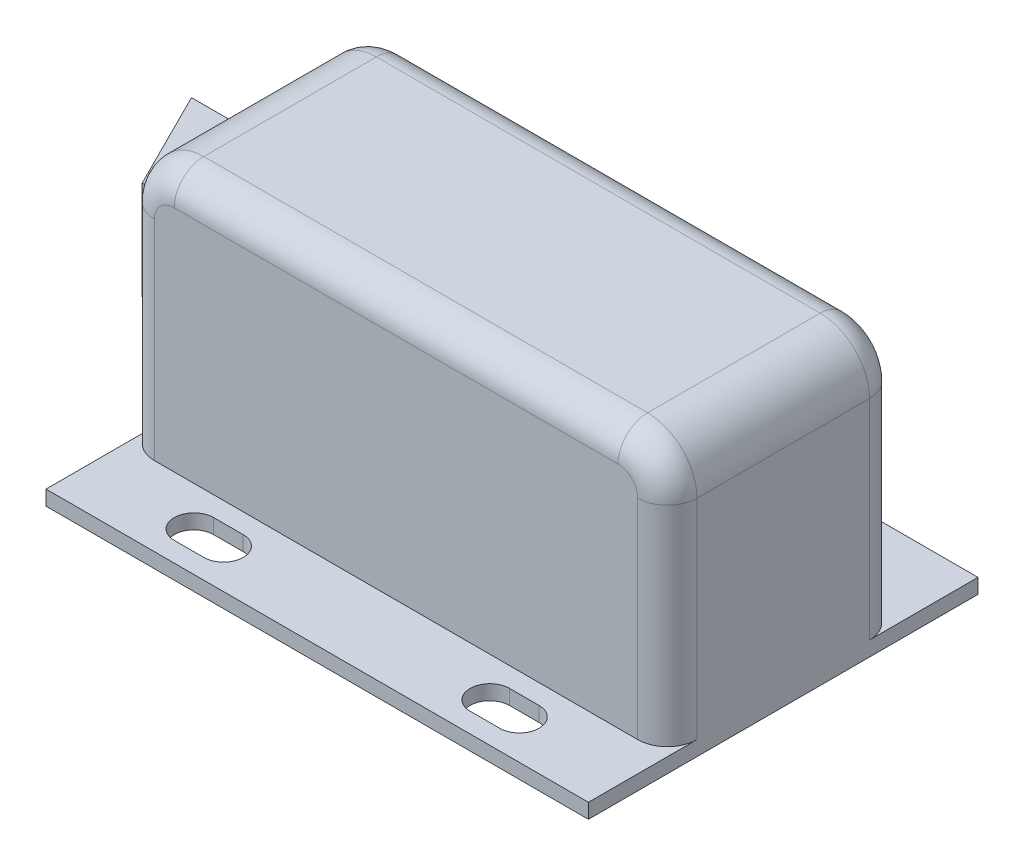
from build123d import *

# Parameters (mm, degrees)
SKETCH1_W           = 55
SKETCH1_H           = 39.5
BOSS_EXTRUDE1_DEPTH = 27.7
SKETCH2_W           = 8
SKETCH2_H           = 26.2
CUT_EXTRUDE1_DEPTH  = 65.877365082
SKETCH3_W           = 8
SKETCH3_H           = 26.2
CUT_EXTRUDE2_DEPTH  = 65.877365082
CUT_EXTRUDE3_DEPTH  = 50.345111207
CUT_EXTRUDE4_DEPTH  = 51.15765146
CUT_EXTRUDE5_DEPTH  = 50.345111207
CUT_EXTRUDE6_DEPTH  = 51.15765146
BOSS_EXTRUDE2_DEPTH = 10
FILLET1_R           = 5
FILLET2_R           = 3


with BuildPart() as part:
    # Sketch1 → Boss-Extrude1 (new body)
    with BuildSketch(Plane(origin=(0, 13.85, 0), x_dir=(1, 0, 0), z_dir=(0, 1, 0))):
        with Locations((0, -11.75)):
            Rectangle(SKETCH1_W, SKETCH1_H)
    extrude(amount=-BOSS_EXTRUDE1_DEPTH)

    # Sketch2 → Cut-Extrude1 (cut, through all)
    with BuildSketch(Plane.ZY.offset(27.5)):
        with Locations((27.5, 0.75)):
            Rectangle(SKETCH2_W, SKETCH2_H)
    extrude(amount=-CUT_EXTRUDE1_DEPTH, mode=Mode.SUBTRACT)

    # Sketch3 → Cut-Extrude2 (cut, through all)
    with BuildSketch(Plane.ZY.offset(27.5)):
        with Locations((-4, 0.75)):
            Rectangle(SKETCH3_W, SKETCH3_H)
    extrude(amount=-CUT_EXTRUDE2_DEPTH, mode=Mode.SUBTRACT)

    # Sketch4 → Cut-Extrude3 (cut, through all)
    with BuildSketch(Plane(origin=(0, -12.35, 0), x_dir=(-1, 0, 0), z_dir=(0, 1, 0))):
        with BuildLine():
            Line((-13.5, -2), (-16.5, -2))
            ThreePointArc((-16.5, -2), (-18.5, -4), (-16.5, -6))
            Line((-16.5, -6), (-13.5, -6))
            ThreePointArc((-13.5, -6), (-11.5, -4), (-13.5, -2))
        make_face()
    extrude(amount=-CUT_EXTRUDE3_DEPTH, mode=Mode.SUBTRACT)

    # Sketch5 → Cut-Extrude4 (cut, through all)
    with BuildSketch(Plane.XZ.offset(13.85)):
        with BuildLine():
            Line((-16.5, -6), (-13.5, -6))
            ThreePointArc((-13.5, -6), (-11.5, -4), (-13.5, -2))
            Line((-13.5, -2), (-16.5, -2))
            ThreePointArc((-16.5, -2), (-18.5, -4), (-16.5, -6))
        make_face()
    extrude(amount=-CUT_EXTRUDE4_DEPTH, mode=Mode.SUBTRACT)

    # Sketch6 → Cut-Extrude5 (cut, through all)
    with BuildSketch(Plane(origin=(0, -12.35, 0), x_dir=(-1, 0, 0), z_dir=(0, 1, 0))):
        with BuildLine():
            Line((16.5, 29.5), (13.5, 29.5))
            ThreePointArc((13.5, 29.5), (11.5, 27.5), (13.5, 25.5))
            Line((13.5, 25.5), (16.5, 25.5))
            ThreePointArc((16.5, 25.5), (18.5, 27.5), (16.5, 29.5))
        make_face()
    extrude(amount=-CUT_EXTRUDE5_DEPTH, mode=Mode.SUBTRACT)

    # Sketch7 → Cut-Extrude6 (cut, through all)
    with BuildSketch(Plane.XZ.offset(13.85)):
        with BuildLine():
            Line((13.5, 25.5), (16.5, 25.5))
            ThreePointArc((16.5, 25.5), (18.5, 27.5), (16.5, 29.5))
            Line((16.5, 29.5), (13.5, 29.5))
            ThreePointArc((13.5, 29.5), (11.5, 27.5), (13.5, 25.5))
        make_face()
    extrude(amount=-CUT_EXTRUDE6_DEPTH, mode=Mode.SUBTRACT)

    # Sketch8 → Boss-Extrude2 (add)
    with BuildSketch(Plane.XZ.offset(5.35)):
        Polygon((-32.5, 16.75), (-37.5, 6.75), (-27.5, 6.75), (-27.5, 16.75), align=None)
    extrude(amount=-BOSS_EXTRUDE2_DEPTH)

    # Fillet1
    fillet1_edges = [part.edges().sort_by_distance(p)[0] for p in [
        (27.5, 13.85, 11.75),
        (-27.5, 13.85, 11.75),
    ]]
    fillet(fillet1_edges, radius=FILLET1_R)

    # Fillet2
    fillet2_edges = [part.edges().sort_by_distance(p)[0] for p in [
        (0, 13.85, 0),
        (0, 13.85, 23.5),
        (-26.035533906, 12.385533906, 0),
        (26.035533906, 12.385533906, 0),
        (27.5, -1.75, 23.5),
        (-27.5, -1.75, 23.5),
        (-26.035533906, 12.385533906, 23.5),
        (26.035533906, 12.385533906, 23.5),
        (27.5, -1.75, 0),
        (-27.5, -1.75, 0),
    ]]
    fillet(fillet2_edges, radius=FILLET2_R)


solid = part.part
